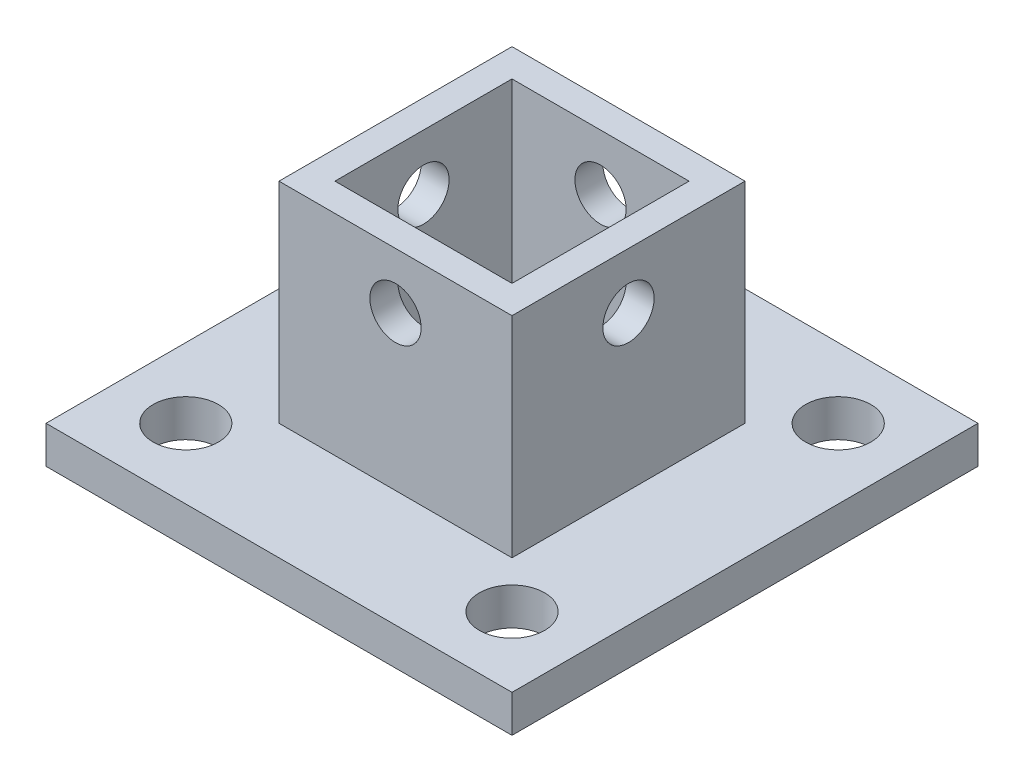
from build123d import *

# Parameters (mm, degrees)
SKETCH1_W               = 50
SKETCH1_H               = 50
SKETCH1_R               = 3.5
BOSS_EXTRUDE1_DEPTH     = 4
SKETCH2_W               = 25
SKETCH2_H               = 25
SKETCH2_W_2             = 19
SKETCH2_H_2             = 19
BOSS_EXTRUDE2_DEPTH     = 22.5
CUT_EXTRUDE1_DEPTH      = 53.282884389
CUT_EXTRUDE1_DEPTH_BACK = 53.282884389
SKETCH3_R               = 2.75
CUT_EXTRUDE2_DEPTH      = 53.282884389
CUT_EXTRUDE2_DEPTH_BACK = 53.282884389
SKETCH4_R               = 2.75


with BuildPart() as part:
    # Sketch1 → Boss-Extrude1 (new body)
    with BuildSketch(Plane(origin=(0, 0, 0), x_dir=(1, 0, 0), z_dir=(0, 1, 0))):
        Rectangle(SKETCH1_W, SKETCH1_H)
        with Locations(Location((-17.5, -17.5, 0), (0, 0, 270))):
            Circle(SKETCH1_R, mode=Mode.SUBTRACT)
        with Locations(Location((17.5, -17.5, 0), (0, 0, 270))):
            Circle(SKETCH1_R, mode=Mode.SUBTRACT)
        with Locations(Location((17.5, 17.5, 0), (0, 0, 270))):
            Circle(SKETCH1_R, mode=Mode.SUBTRACT)
        with Locations(Location((-17.5, 17.5, 0), (0, 0, 270))):
            Circle(SKETCH1_R, mode=Mode.SUBTRACT)
    extrude(amount=BOSS_EXTRUDE1_DEPTH)

    # Sketch2 → Boss-Extrude2 (add)
    with BuildSketch(Plane(origin=(0, 4, 0), x_dir=(1, 0, 0), z_dir=(0, 1, 0))):
        Rectangle(SKETCH2_W, SKETCH2_H)
        Rectangle(SKETCH2_W_2, SKETCH2_H_2, mode=Mode.SUBTRACT)
    extrude(amount=BOSS_EXTRUDE2_DEPTH)

    # Sketch3 → Cut-Extrude1 (cut, two sides: drawn at the far end of the back side and taken through both)
    with BuildSketch(Plane.ZY.offset(12.5).offset(-CUT_EXTRUDE1_DEPTH_BACK)):
        with Locations((0, 20.5)):
            Circle(SKETCH3_R)
    extrude(amount=CUT_EXTRUDE1_DEPTH + CUT_EXTRUDE1_DEPTH_BACK, mode=Mode.SUBTRACT)

    # Sketch4 → Cut-Extrude2 (cut, two sides: drawn at the far end of the back side and taken through both)
    with BuildSketch(Plane.XY.offset(12.5).offset(-CUT_EXTRUDE2_DEPTH_BACK)):
        with Locations((0, 20.5)):
            Circle(SKETCH4_R)
    extrude(amount=CUT_EXTRUDE2_DEPTH + CUT_EXTRUDE2_DEPTH_BACK, mode=Mode.SUBTRACT)


solid = part.part
